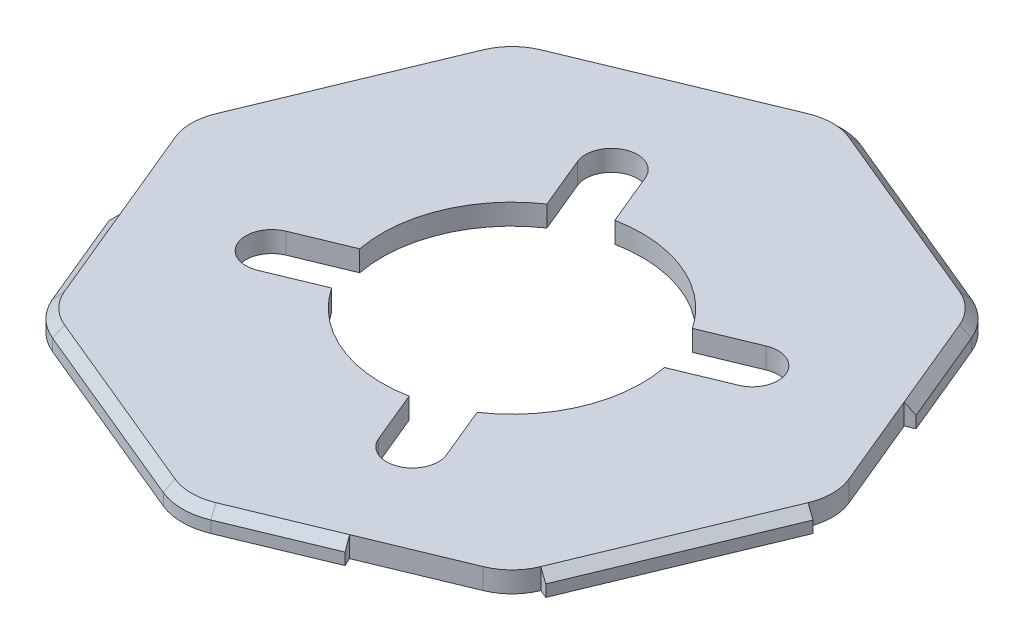
from build123d import *

# Parameters (mm, degrees)
BOSS_EXTRUDE1_DEPTH = 1.6
CHAMFER1_SIZE       = 0.7
CUT_EXTRUDE1_DEPTH  = 10
CUT_EXTRUDE2_DEPTH  = 10


with BuildPart() as part:
    # Sketch1 → Boss-Extrude1 (new body)
    with BuildSketch(Plane(origin=(0, 0, 0), x_dir=(1, 0, 0), z_dir=(0, 1, 0))):
        with BuildLine():
            Line((-9.10786569, -21.988332874), (-1.836880475, -25.000073562))
            ThreePointArc((-1.836880475, -25.000073562), (0, -25.365451806), (1.836880475, -25.000073562))
            Line((1.836880475, -25.000073562), (16.378850905, -18.976592186))
            ThreePointArc((16.378850905, -18.976592186), (17.93608298, -17.93608298), (18.976592186, -16.378850905))
            Line((18.976592186, -16.378850905), (25.000073562, -1.836880475))
            ThreePointArc((25.000073562, -1.836880475), (25.365451806, 0), (25.000073562, 1.836880475))
            Line((25.000073562, 1.836880475), (18.976592186, 16.378850905))
            ThreePointArc((18.976592186, 16.378850905), (17.93608298, 17.93608298), (16.378850905, 18.976592186))
            Line((16.378850905, 18.976592186), (1.836880475, 25.000073562))
            ThreePointArc((1.836880475, 25.000073562), (0, 25.365451806), (-1.836880475, 25.000073562))
            Line((-1.836880475, 25.000073562), (-16.378850905, 18.976592186))
            ThreePointArc((-16.378850905, 18.976592186), (-17.93608298, 17.93608298), (-18.976592186, 16.378850905))
            Line((-18.976592186, 16.378850905), (-25.000073562, 1.836880475))
            ThreePointArc((-25.000073562, 1.836880475), (-25.365451806, 0), (-25.000073562, -1.836880475))
            Line((-25.000073562, -1.836880475), (-18.976592186, -16.378850905))
            ThreePointArc((-18.976592186, -16.378850905), (-17.93608298, -17.93608298), (-16.378850905, -18.976592186))
            Line((-16.378850905, -18.976592186), (-9.10786569, -21.988332874))
        make_face()
    extrude(amount=BOSS_EXTRUDE1_DEPTH)

    # Chamfer1
    chamfer1_edges = [part.edges().sort_by_distance(p)[0] for p in [
        (25.365451806, 1.6, 0),
        (21.988332874, 1.6, 9.10786569),
        (17.93608298, 1.6, 17.93608298),
        (9.10786569, 1.6, 21.988332874),
        (0, 1.6, 25.365451806),
        (-9.10786569, 1.6, 21.988332874),
        (-17.93608298, 1.6, 17.93608298),
        (-21.988332874, 1.6, 9.10786569),
        (-25.365451806, 1.6, 0),
        (-21.988332874, 1.6, -9.10786569),
        (-17.93608298, 1.6, -17.93608298),
        (-9.10786569, 1.6, -21.988332874),
        (0, 1.6, -25.365451806),
        (9.10786569, 1.6, -21.988332874),
        (17.93608298, 1.6, -17.93608298),
        (21.988332874, 1.6, -9.10786569),
    ]]
    chamfer(chamfer1_edges, length=CHAMFER1_SIZE)

    # Sketch3 → Cut-Extrude1 (cut)
    with BuildSketch(Plane(origin=(0, 1.6, 0), x_dir=(1, 0, 0), z_dir=(0, 1, 0))):
        with BuildLine():
            Line((11.184254927, -26.400355762), (8.839987288, -21.341617201))
            Line((8.839987288, -21.341617201), (16.110972503, -18.329876513))
            ThreePointArc((16.110972503, -18.329876513), (17.441108233, -17.441108233), (18.329876513, -16.110972503))
            Line((18.329876513, -16.110972503), (20.565451806, -17.036978108))
            Line((20.565451806, -17.036978108), (27.482751604, -2.865239392))
            Line((27.482751604, -2.865239392), (24.353357889, -1.569002073))
            ThreePointArc((24.353357889, -1.569002073), (24.665451806, 0), (24.353357889, 1.569002073))
            Line((24.353357889, 1.569002073), (21.341617201, 8.839987288))
            Line((21.341617201, 8.839987288), (23.946233788, 9.918854803))
            Line((23.946233788, 9.918854803), (36.794025395, -9.102301388))
            Line((36.794025395, -9.102301388), (11.184254927, -26.400355762))
        make_face()
        with BuildLine():
            Line((-8.839987288, 21.341617201), (-16.110972503, 18.329876513))
            ThreePointArc((-16.110972503, 18.329876513), (-17.441108233, 17.441108233), (-18.329876513, 16.110972503))
            Line((-18.329876513, 16.110972503), (-20.565451806, 17.036978108))
            Line((-20.565451806, 17.036978108), (-26.15363219, 2.314700104))
            Line((-26.15363219, 2.314700104), (-24.353357889, 1.569002073))
            ThreePointArc((-24.353357889, 1.569002073), (-24.665451806, 0), (-24.353357889, -1.569002073))
            Line((-24.353357889, -1.569002073), (-21.341617201, -8.839987288))
            Line((-21.341617201, -8.839987288), (-32.211044195, -10.986258031))
            Line((-32.211044195, -10.986258031), (-37.928163695, 17.967131565))
            Line((-37.928163695, 17.967131565), (-9.747163954, 23.531735412))
            Line((-9.747163954, 23.531735412), (-8.839987288, 21.341617201))
        make_face()
    extrude(amount=-CUT_EXTRUDE1_DEPTH, mode=Mode.SUBTRACT)

    # Sketch4 → Cut-Extrude2 (cut)
    with BuildSketch(Plane(origin=(0, 1.6, 0), x_dir=(1, 0, 0), z_dir=(0, 1, 0))):
        with BuildLine():
            Line((-7.259720066, 12.300262784), (-5.597275634, 8.286766889))
            ThreePointArc((-5.597275634, 8.286766889), (-9.238795325, 3.826834324), (-9.817500619, -1.901757504))
            Line((-9.817500619, -1.901757504), (-13.830996513, -3.564201936))
            ThreePointArc((-13.830996513, -3.564201936), (-14.913253575, -6.177654038), (-12.299610465, -7.259449732))
            Line((-12.299610465, -7.259449732), (-8.287642823, -5.595978595))
            ThreePointArc((-8.287642823, -5.595978595), (-3.827557299, -9.238495826), (1.901757504, -9.817500619))
            Line((1.901757504, -9.817500619), (3.564201936, -13.830996513))
            ThreePointArc((3.564201936, -13.830996513), (6.177327866, -14.913388714), (7.259720066, -12.300262784))
            Line((7.259720066, -12.300262784), (5.597275634, -8.286766889))
            ThreePointArc((5.597275634, -8.286766889), (9.240445033, -3.822849145), (9.815856456, 1.910225649))
            Line((9.815856456, 1.910225649), (14.012213043, 3.650149468))
            ThreePointArc((14.012213043, 3.650149468), (14.872687986, 6.269014189), (12.300262784, 7.259720066))
            Line((12.300262784, 7.259720066), (8.286766889, 5.597275634))
            ThreePointArc((8.286766889, 5.597275634), (3.826834324, 9.238795325), (-1.901757504, 9.817500619))
            Line((-1.901757504, 9.817500619), (-3.564201936, 13.830996513))
            ThreePointArc((-3.564201936, 13.830996513), (-6.177327866, 14.913388714), (-7.259720066, 12.300262784))
        make_face()
    extrude(amount=-CUT_EXTRUDE2_DEPTH, mode=Mode.SUBTRACT)


solid = part.part
